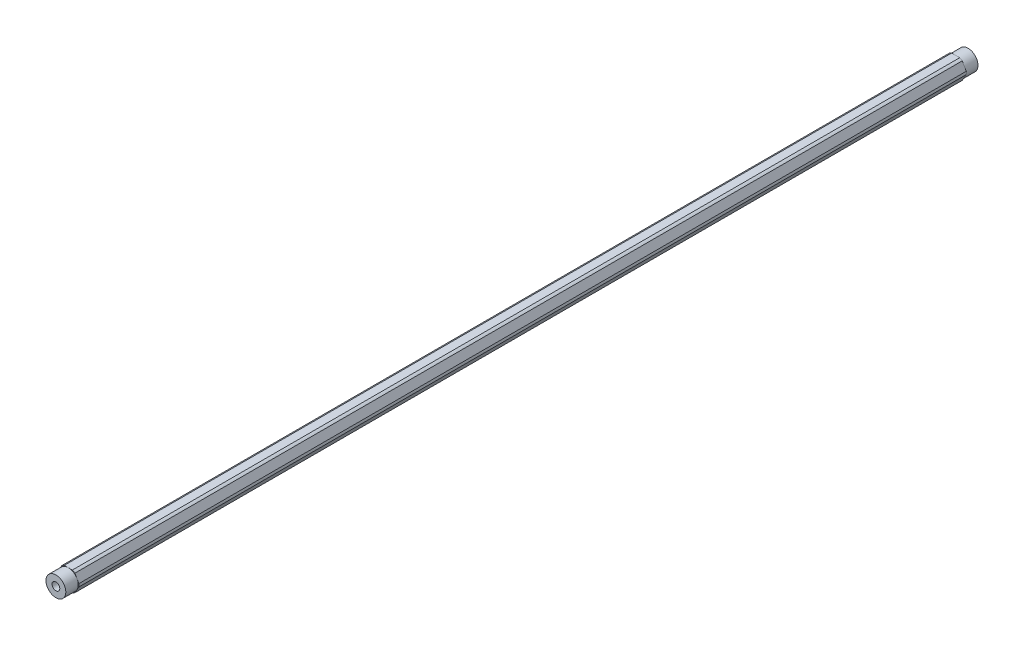
from build123d import *

# Parameters (mm, degrees)
BOSS_EXTRUDE1_DEPTH = 292.1
SKETCH3_OUTSIDE_W   = 133.568
SKETCH3_OUTSIDE_H   = 131.604
SKETCH3_OUTSIDE_R   = 6.35
CUT_EXTRUDE2_DEPTH  = 7.9502
SKETCH4_OUTSIDE_W   = 133.568
SKETCH4_OUTSIDE_H   = 131.604
SKETCH4_OUTSIDE_R   = 6.858
CUT_EXTRUDE3_DEPTH  = 585.280519813
SKETCH5_R           = 2.4892
CUT_EXTRUDE4_DEPTH  = 585.274759564


with BuildPart() as part:
    # Sketch1 → Boss-Extrude1 (new, symmetric)
    with BuildSketch(Plane.XY):
        Polygon((7.332348419, 0), (3.666174209, 6.35), (-3.666174209, 6.35), (-7.332348419, 0), (-3.666174209, -6.35), (3.666174209, -6.35), align=None)
    extrude(amount=BOSS_EXTRUDE1_DEPTH, both=True)

    # Sketch3 outside → Cut-Extrude2 (cut)
    with BuildSketch(Plane.XY.offset(292.1)):
        Rectangle(SKETCH3_OUTSIDE_W, SKETCH3_OUTSIDE_H)
        Circle(SKETCH3_OUTSIDE_R, mode=Mode.SUBTRACT)
    cut_extrude2 = extrude(amount=-CUT_EXTRUDE2_DEPTH, mode=Mode.SUBTRACT)

    # Mirror1: Cut-Extrude2 across plane
    add(cut_extrude2.mirror(Plane.XY), mode=Mode.SUBTRACT)

    # Sketch4 outside → Cut-Extrude3 (cut, through all)
    with BuildSketch(Plane.XY.offset(292.1)):
        Rectangle(SKETCH4_OUTSIDE_W, SKETCH4_OUTSIDE_H)
        Circle(SKETCH4_OUTSIDE_R, mode=Mode.SUBTRACT)
    extrude(amount=-CUT_EXTRUDE3_DEPTH, mode=Mode.SUBTRACT)

    # Sketch5 → Cut-Extrude4 (cut, through all)
    with BuildSketch(Plane.XY.offset(292.1)):
        Circle(SKETCH5_R)
    extrude(amount=-CUT_EXTRUDE4_DEPTH, mode=Mode.SUBTRACT)


solid = part.part
